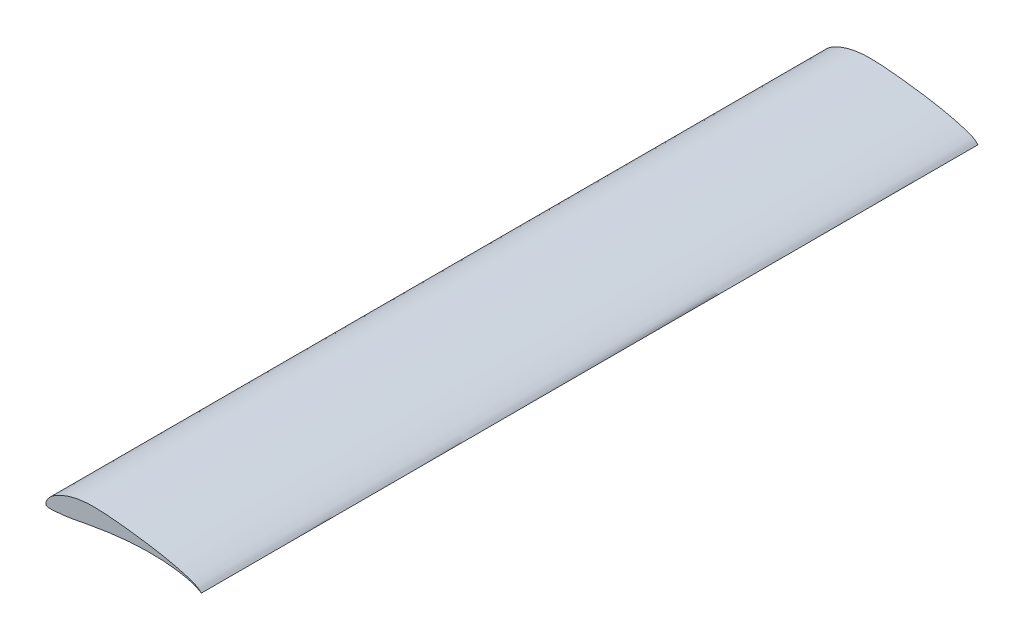
from build123d import *

# Parameters (mm, degrees)
BOSS_EXTRUDE1_DEPTH = 952.5


with BuildPart() as part:
    # Sketch1 → Boss-Extrude1 (new body)
    with BuildSketch(Plane.XY):
        with BuildLine():
            add(Edge.make_bspline(
                [(190.5, 0), (190.50114045, 0.004849596), (189.874896953, 0.471443658), (189.345268774, 0.991100653), (188.169280274, 2.076506623), (186.781888796, 3.231171027), (184.884056421, 4.395201218), (182.524087437, 5.523278068), (179.675049468, 6.700562898), (176.341285283, 7.910663106), (172.538347889, 9.145030234), (168.285979658, 10.392947032), (163.607992669, 11.648556379), (158.530216744, 12.900329382), (153.081764098, 14.139204517), (147.295108851, 15.357443778), (141.205587005, 16.548784485), (134.84878908, 17.698566485), (128.264745028, 18.805147072), (121.49139922, 19.854276891), (114.572555058, 20.848004574), (107.552554075, 21.778455325), (100.48224217, 22.642651753), (93.418141124, 23.446712837), (86.418731173, 24.170350038), (79.541035437, 24.800019665), (72.833426008, 25.300280471), (66.334219213, 25.644395699), (60.079572264, 25.793000688), (54.101526828, 25.777182658), (48.411234272, 25.484480075), (43.006490333, 24.891331475), (37.865293507, 24.05261056), (32.986402962, 22.966055018), (28.374831045, 21.691917078), (24.050089889, 20.252763674), (20.030572218, 18.682249461), (16.341255786, 16.988788676), (12.993972054, 15.206763446), (10.006931348, 13.356438838), (7.398865706, 11.462888358), (5.170851216, 9.566248098), (3.355198002, 7.645814805), (1.960544743, 5.718219472), (0.930349506, 3.842925922), (0.270103383, 2.062423545), (-0.044503927, 0.419020389), (0.016223798, -0.970909151), (0.374066578, -2.245698506), (1.704225489, -2.87851328), (3.49264161, -2.9672952), (5.939188196, -3.053342986), (9.015893195, -2.920669006), (12.687983762, -2.676854663), (16.914593363, -2.286316955), (21.652472068, -1.757902645), (26.878516736, -1.080272914), (32.590173476, -0.133184537), (38.815251855, 1.054448935), (45.584873075, 2.346973137), (52.865947778, 3.71169339), (60.612743159, 5.091964511), (68.768366475, 6.435986546), (77.269545833, 7.69887908), (86.043018462, 8.834314674), (95.009886978, 9.809232182), (104.085447691, 10.579864329), (113.17862511, 11.126147499), (122.194418874, 11.426469616), (131.035023441, 11.464402451), (139.601808023, 11.237368645), (147.796677859, 10.750683104), (155.521090801, 10.010625382), (162.683083088, 9.045602512), (169.189407873, 7.883615818), (174.96378138, 6.563581677), (179.899784557, 5.151086339), (183.939394111, 3.643549372), (186.821551542, 2.263960045), (188.946489274, 0.988345413), (189.762798975, 0.494703594), (190.498836365, -0.004948188), (190.5, 0)],
                knots=[0, 0, 0, 0, 0.000979678, 0.003648862, 0.007483499, 0.012095277, 0.017525591, 0.02405178, 0.031783051, 0.040677828, 0.050710301, 0.061833229, 0.07398925, 0.087118173, 0.101145049, 0.115990637, 0.131570422, 0.147788379, 0.164550917, 0.181757895, 0.199311955, 0.217095072, 0.234990228, 0.252856883, 0.270540594, 0.287886779, 0.304773438, 0.321101419, 0.336806063, 0.351800033, 0.366031063, 0.379615675, 0.392652963, 0.405170359, 0.417171919, 0.428603517, 0.439418959, 0.449596586, 0.459102079, 0.467907878, 0.475988301, 0.483308969, 0.489874508, 0.49580325, 0.501149412, 0.505903073, 0.510046769, 0.513579311, 0.516446927, 0.519350053, 0.523823355, 0.529973794, 0.537715654, 0.546967844, 0.557637367, 0.569620481, 0.582804124, 0.597246961, 0.613135037, 0.6304436, 0.649056124, 0.668822257, 0.689594964, 0.711189651, 0.733426689, 0.756094118, 0.778988554, 0.801889683, 0.824566598, 0.846792285, 0.868338291, 0.888978163, 0.908492011, 0.926658768, 0.943286193, 0.95816921, 0.971135822, 0.981955623, 0.990251791, 0.995852565, 0.999000406, 1, 1, 1, 1], degree=3))
        make_face()
    extrude(amount=BOSS_EXTRUDE1_DEPTH)


solid = part.part
